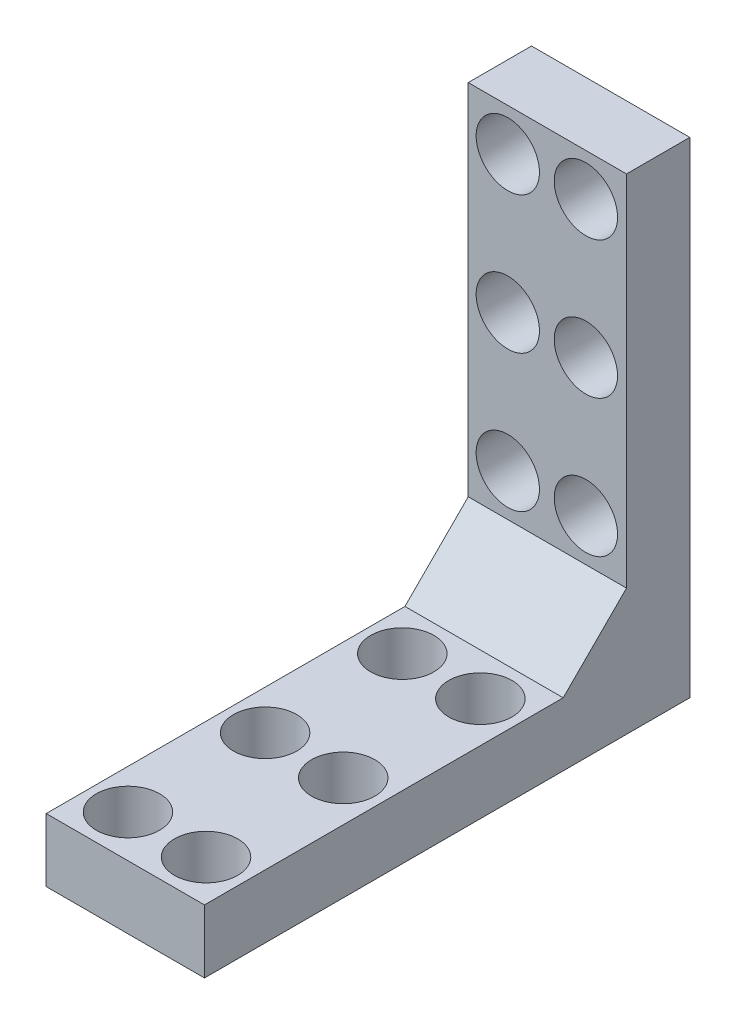
from build123d import *

# Parameters (mm, degrees)
BOSS_EXTRUDE1_DEPTH  = 7.5
CHAMFER1_SIZE        = 3
SKETCH3_R            = 1.5
CUT_EXTRUDE1_DEPTH   = 10
SKETCH4_R            = 1.5
CUT_EXTRUDE2_DEPTH   = 10
LPATTERN1_COUNT      = 2
LPATTERN1_PITCH      = 3.7
LPATTERN1_COUNT_DIR2 = 5
LPATTERN1_PITCH_DIR2 = 3.25
LPATTERN2_COUNT      = 2
LPATTERN2_PITCH      = 3.7
LPATTERN2_COUNT_DIR2 = 5
LPATTERN2_PITCH_DIR2 = 3.25


with BuildPart() as part:
    # Sketch1 → Boss-Extrude1 (new body)
    with BuildSketch(Plane(origin=(0, 0, 0), x_dir=(0, 0, -1), z_dir=(1, 0, 0))):
        Polygon((0, 0), (0, 3), (20, 3), (20, 23), (23, 23), (23, 0), align=None)
    extrude(amount=BOSS_EXTRUDE1_DEPTH)

    # Chamfer1
    chamfer1_edges = [part.edges().sort_by_distance(p)[0] for p in [
        (3.75, 3, -20),
    ]]
    chamfer(chamfer1_edges, length=CHAMFER1_SIZE)

    # Sketch3 → Cut-Extrude1 (cut)
    with BuildSketch(Plane.XY.offset(-20)):
        with Locations((1.875, 21)):
            Circle(SKETCH3_R)
    cut_extrude1 = extrude(amount=-CUT_EXTRUDE1_DEPTH, mode=Mode.SUBTRACT)

    # Sketch4 → Cut-Extrude2 (cut)
    with BuildSketch(Plane(origin=(0, 3, 0), x_dir=(1, 0, 0), z_dir=(0, 1, 0))):
        with Locations(Location((1.875, 2, 0), (0, 0, 270))):
            Circle(SKETCH4_R)
    cut_extrude2 = extrude(amount=-CUT_EXTRUDE2_DEPTH, mode=Mode.SUBTRACT)

    # LPattern1: Cut-Extrude1 2 × 5, 4 skipped
    with Locations(*[(i * LPATTERN1_PITCH, -j * LPATTERN1_PITCH_DIR2, 0) for i in range(LPATTERN1_COUNT) for j in range(LPATTERN1_COUNT_DIR2) if (i, j) not in ((0, 0), (0, 1), (0, 3), (1, 1), (1, 3))]):
        add(cut_extrude1, mode=Mode.SUBTRACT)

    # LPattern2: Cut-Extrude2 2 × 5, 4 skipped
    with Locations(*[(i * LPATTERN2_PITCH, 0, -j * LPATTERN2_PITCH_DIR2) for i in range(LPATTERN2_COUNT) for j in range(LPATTERN2_COUNT_DIR2) if (i, j) not in ((0, 0), (0, 1), (0, 3), (1, 1), (1, 3))]):
        add(cut_extrude2, mode=Mode.SUBTRACT)


solid = part.part
